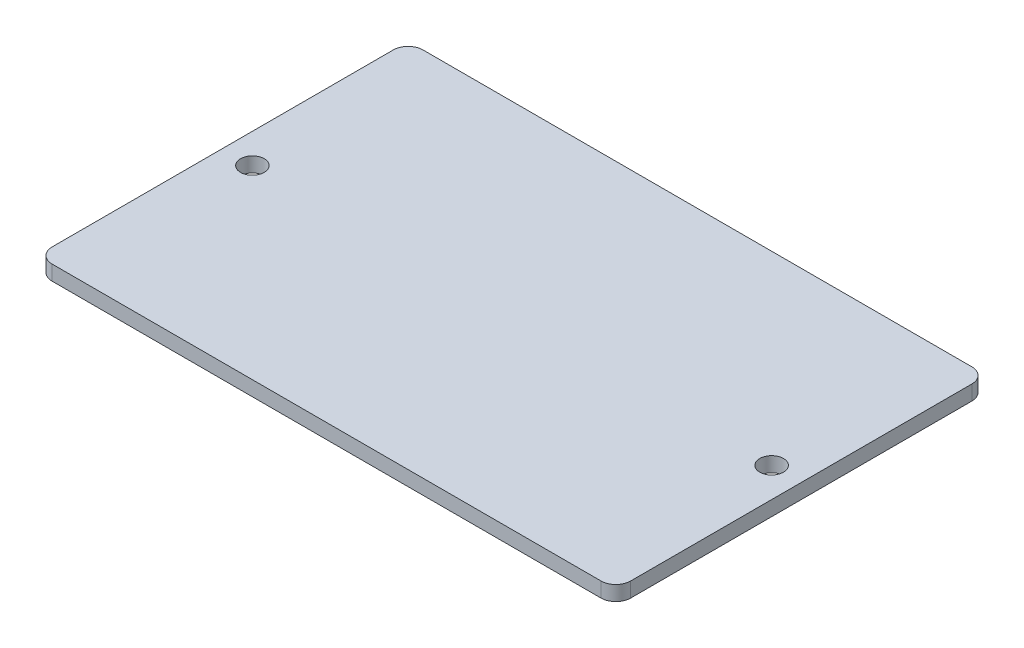
from build123d import *

# Parameters (mm, degrees)
SKETCH_1_R      = 1.6
EXTRUDE_1_DEPTH = 2


with BuildPart() as part:
    # 草图1 → 凸台-拉伸1 (new body)
    with BuildSketch(Plane(origin=(0, 0, 0), x_dir=(1, 0, 0), z_dir=(0, 1, 0))):
        with BuildLine():
            Line((-37, -25), (37, -25))
            ThreePointArc((37, -25), (38.414213562, -24.414213562), (39, -23))
            Line((39, -23), (39, 23))
            ThreePointArc((39, 23), (38.414213562, 24.414213562), (37, 25))
            Line((37, 25), (-37, 25))
            ThreePointArc((-37, 25), (-38.414213562, 24.414213562), (-39, 23))
            Line((-39, 23), (-39, -23))
            ThreePointArc((-39, -23), (-38.414213562, -24.414213562), (-37, -25))
        make_face()
        with Locations(Location((-35, 0, 0), (0, 0, 270))):
            Circle(SKETCH_1_R, mode=Mode.SUBTRACT)
        with Locations(Location((35, 0, 0), (0, 0, 90))):
            Circle(SKETCH_1_R, mode=Mode.SUBTRACT)
    extrude(amount=EXTRUDE_1_DEPTH)


solid = part.part
